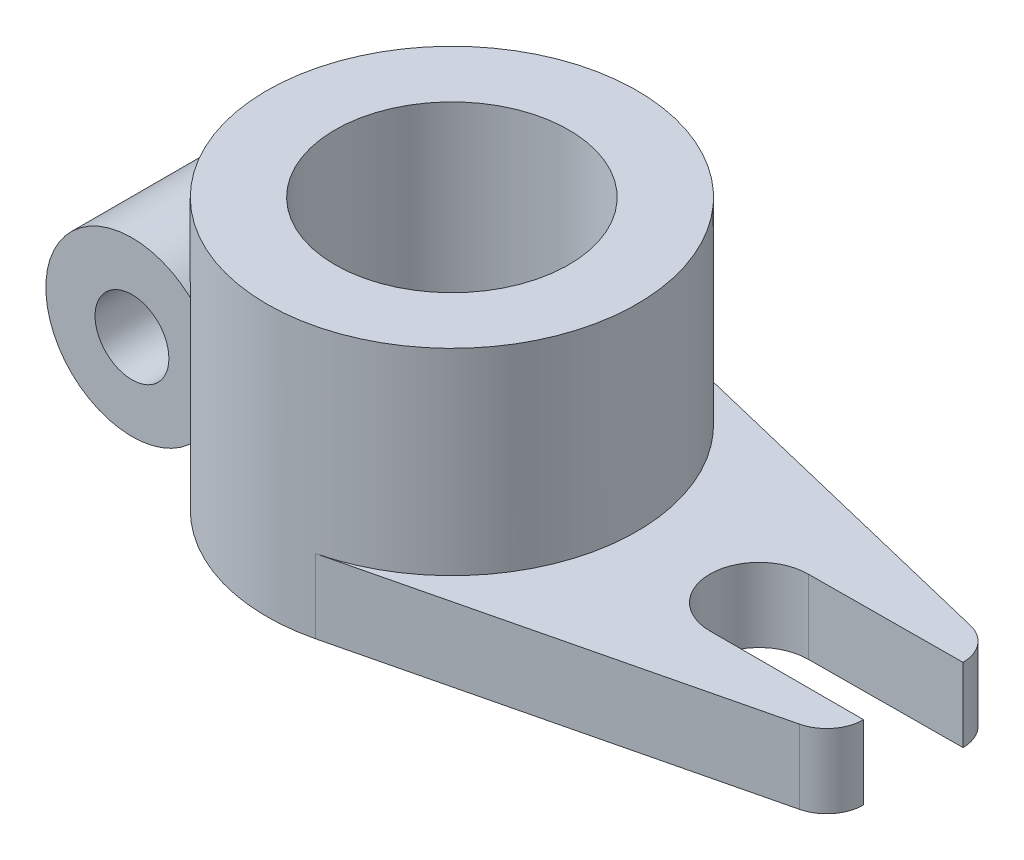
from build123d import *

# Parameters (mm, degrees)
SKETCH_1_R           = 19
EXTRUDE_1_DEPTH      = 44
EXTRUDE_2_DEPTH      = 12
EXTRUDE_3_DEPTH      = 16
EXTRUDE_3_DEPTH_BACK = 16
SKETCH_2_R           = 14
SKETCH_2_R_2         = 6


with BuildPart() as part:
    # 草图1 → 凸台-拉伸1 (new body)
    with BuildSketch(Plane(origin=(0, 0, 0), x_dir=(1, 0, 0), z_dir=(0, 1, 0))):
        with BuildLine():
            ThreePointArc((30.073213795, 0.075325719), (23.638095307, 18.666684955), (7.08673549, 29.301621551))
            ThreePointArc((7.08673549, 29.301621551), (-30.073212741, 0.083288408), (7.071257605, -29.154718822))
            ThreePointArc((7.071257605, -29.154718822), (23.633171917, -18.522291685), (30.073213795, 0.075325719))
        make_face()
        with Locations((0, 0.075325719)):
            Circle(SKETCH_1_R, mode=Mode.SUBTRACT)
    extrude(amount=EXTRUDE_1_DEPTH)

    # 草图1<3> → 凸台-拉伸2 (add)
    with BuildSketch(Plane(origin=(0, 0, 0), x_dir=(1, 0, 0), z_dir=(0, 1, 0))):
        with BuildLine():
            ThreePointArc((50, -8), (42, 0), (50, 8))
            Line((50, 8), (75, 8.150651437))
            ThreePointArc((75, 8.150651437), (73.70484886, 11.838399085), (70.413394867, 13.946296092))
            Line((70.413394867, 13.946296092), (7.08673549, 29.301621551))
            ThreePointArc((7.08673549, 29.301621551), (23.638095307, 18.666684955), (30.073213795, 0.075325719))
            ThreePointArc((30.073213795, 0.075325719), (23.633171917, -18.522291685), (7.071257605, -29.154718822))
            Line((7.071257605, -29.154718822), (70.4108085, -13.831776691))
            ThreePointArc((70.4108085, -13.831776691), (73.715127305, -11.710468232), (75, -8))
            Line((75, -8), (50, -8))
        make_face()
    extrude(amount=EXTRUDE_2_DEPTH)

    # 草图2 → 凸台-拉伸3 (add, two sides: drawn at the far end of the back side and taken through both)
    with BuildSketch(Plane.XY.offset(-EXTRUDE_3_DEPTH_BACK)):
        with Locations((-35.926786205, 14.387019523)):
            Circle(SKETCH_2_R)
        with Locations((-35.926786205, 14.387019523)):
            Circle(SKETCH_2_R_2, mode=Mode.SUBTRACT)
    extrude(amount=EXTRUDE_3_DEPTH + EXTRUDE_3_DEPTH_BACK)


solid = part.part
